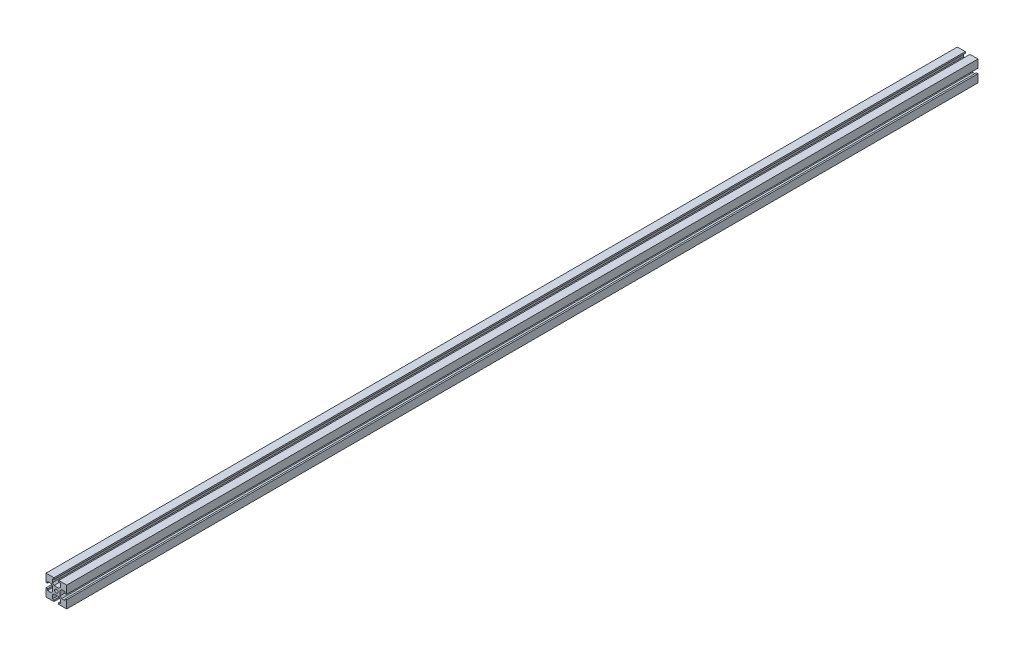
from build123d import *

# Parameters (mm, degrees)
SKETCH_2_R      = 1.25
EXTRUDE_1_DEPTH = 660


with BuildPart() as part:
    # ｽｹｯﾁ2 → ﾎﾞｽ - 押し出し1 (new body)
    with BuildSketch(Plane.XY):
        Polygon((1.7, 2.65), (-1.7, 2.65), (-2.85, 3.8), (-2.85, 6.4), (-1.7, 6.4), (-1.7, 7.5), (-7.5, 7.5), (-7.5, 1.7), (-6.4, 1.7), (-6.4, 2.85), (-3.8, 2.85), (-2.65, 1.7), (-2.65, -1.7), (-3.8, -2.85), (-6.4, -2.85), (-6.4, -1.7), (-7.5, -1.7), (-7.5, -7.5), (-1.7, -7.5), (-1.7, -6.4), (-2.85, -6.4), (-2.85, -3.8), (-1.7, -2.65), (1.7, -2.65), (2.85, -3.8), (2.85, -6.4), (1.7, -6.4), (1.7, -7.5), (7.5, -7.5), (7.5, -1.7), (6.4, -1.7), (6.4, -2.85), (3.8, -2.85), (2.65, -1.7), (2.65, 1.7), (3.8, 2.85), (6.4, 2.85), (6.4, 1.7), (7.5, 1.7), (7.5, 7.5), (1.7, 7.5), (1.7, 6.4), (2.85, 6.4), (2.85, 3.8), align=None)
        Circle(SKETCH_2_R, mode=Mode.SUBTRACT)
    extrude(amount=EXTRUDE_1_DEPTH)


solid = part.part
